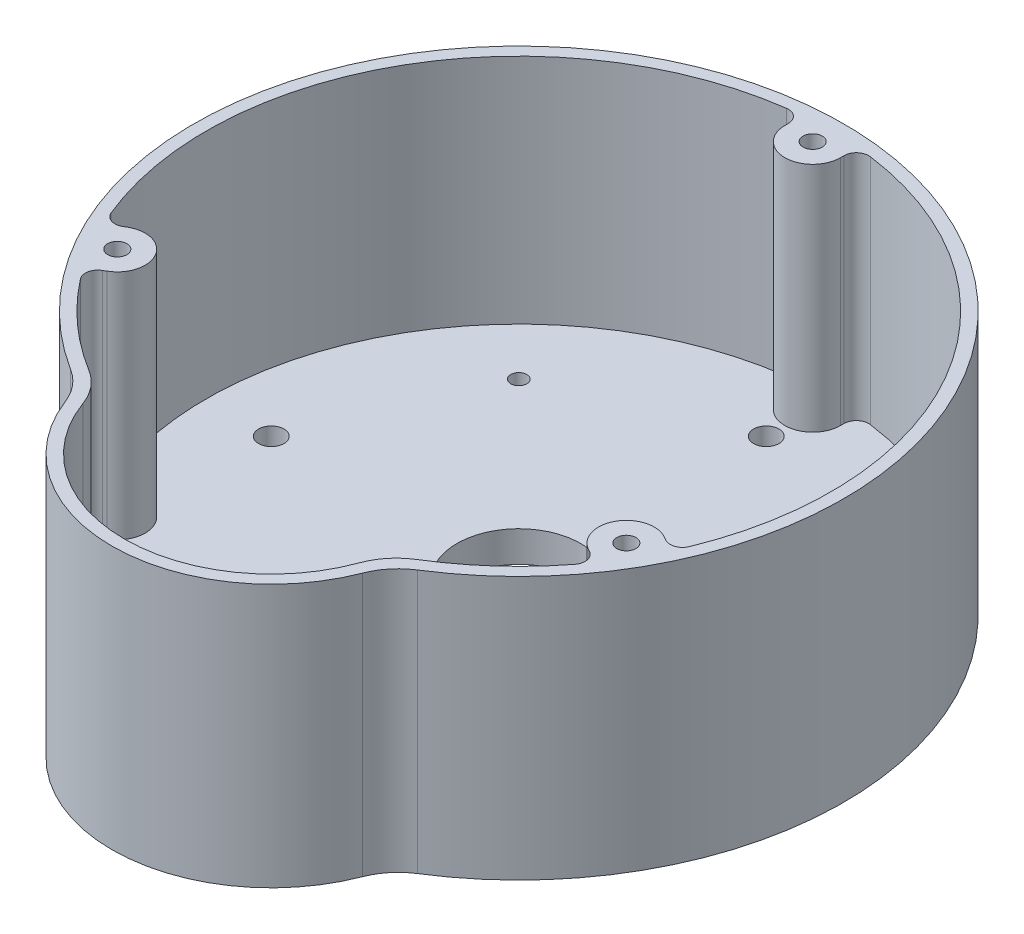
from build123d import *

# Parameters (mm, degrees)
ESQUISSE1_R             = 52.5
ESQUISSE1_R_2           = 2.05
ESQUISSE1_R_3           = 1.3
ESQUISSE1_R_4           = 10
BOSS_EXTRU_2_DEPTH      = 5
ESQUISSE2_R             = 52.5
BOSS_EXTRU_3_DEPTH      = 37.5
ENL_V_START             = -4
ESQUISSE3_R             = 3.35
ENL_V_MAT_EXTRU_1_DEPTH = 82.549693161
ESQUISSE5_R             = 1.55
ENL_V_MAT_EXTRU_3_DEPTH = 86.549693161
ESQUISSE6_R             = 3.75
ENL_V_MAT_EXTRU_4_DEPTH = 3
ESQUISSE7_W             = 25
ESQUISSE7_H             = 37.5
ENL_V_MAT_EXTRU_5_DEPTH = 86.549693161
BOSS_EXTRU_5_DEPTH      = 5
BOSS_EXTRU_9_DEPTH      = 37.5
CONG_1_R                = 10


with BuildPart() as part:
    # Esquisse1 → Boss.-Extru.2 (new body)
    with BuildSketch(Plane(origin=(0, 0, 0), x_dir=(1, 0, 0), z_dir=(0, 1, 0))):
        with Locations(Location((0, 0, 0), (0, 0, 270))):
            Circle(ESQUISSE1_R)
        with Locations(Location((0, 40, 0), (0, 0, 270))):
            Circle(ESQUISSE1_R_2, mode=Mode.SUBTRACT)
        with Locations(Location((40, 0, 0), (0, 0, 270))):
            Circle(ESQUISSE1_R_2, mode=Mode.SUBTRACT)
        with Locations(Location((0, -40, 0), (0, 0, 270))):
            Circle(ESQUISSE1_R_2, mode=Mode.SUBTRACT)
        with Locations(Location((-40, 0, 0), (0, 0, 270))):
            Circle(ESQUISSE1_R_2, mode=Mode.SUBTRACT)
        with Locations(Location((28, 28, 0), (0, 0, 270))):
            Circle(ESQUISSE1_R_3, mode=Mode.SUBTRACT)
        with Locations(Location((20, -42, 0), (0, 0, 270))):
            Circle(ESQUISSE1_R_3, mode=Mode.SUBTRACT)
        with Locations(Location((-20, -42, 0), (0, 0, 90))):
            Circle(ESQUISSE1_R_3, mode=Mode.SUBTRACT)
        with Locations(Location((-28, 28, 0), (0, 0, 90))):
            Circle(ESQUISSE1_R_3, mode=Mode.SUBTRACT)
        with Locations(Location((0, 0, 0), (0, 0, 270))):
            Circle(ESQUISSE1_R_4, mode=Mode.SUBTRACT)
    extrude(amount=BOSS_EXTRU_2_DEPTH)

    # Esquisse2 → Boss.-Extru.3 (add)
    with BuildSketch(Plane(origin=(0, 5, 0), x_dir=(1, 0, 0), z_dir=(0, 1, 0))):
        with Locations(Location((0, 0, 0), (0, 0, 270))):
            Circle(ESQUISSE2_R)
        with BuildLine():
            ThreePointArc((-4.5, 47.5), (0, 43), (4.5, 47.5))
            Line((4.5, 47.5), (4.5, 48.062459363))
            ThreePointArc((4.5, 48.062459363), (5.183960957, 49.568461102), (6.768041237, 50.04441645))
            ThreePointArc((6.768041237, 50.04441645), (43.734282891, 25.25), (46.723756582, -19.16091258))
            ThreePointArc((46.723756582, -19.16091258), (45.519527019, -20.29478867), (43.873310777, -20.134115364))
            Line((43.873310777, -20.134115364), (43.38620668, -19.852885683))
            ThreePointArc((43.38620668, -19.852885683), (37.239092363, -21.5), (38.88620668, -27.647114317))
            Line((38.88620668, -27.647114317), (39.373310777, -27.928343998))
            ThreePointArc((39.373310777, -27.928343998), (40.335566062, -29.273672432), (39.955715345, -30.88350387))
            ThreePointArc((39.955715345, -30.88350387), (0, -50.5), (-39.955715345, -30.88350387))
            ThreePointArc((-39.955715345, -30.88350387), (-40.335566062, -29.273672432), (-39.373310777, -27.928343998))
            Line((-39.373310777, -27.928343998), (-38.88620668, -27.647114317))
            ThreePointArc((-38.88620668, -27.647114317), (-37.239092363, -21.5), (-43.38620668, -19.852885683))
            Line((-43.38620668, -19.852885683), (-43.873310777, -20.134115364))
            ThreePointArc((-43.873310777, -20.134115364), (-45.519527019, -20.29478867), (-46.723756582, -19.16091258))
            ThreePointArc((-46.723756582, -19.16091258), (-43.734282891, 25.25), (-6.768041237, 50.04441645))
            ThreePointArc((-6.768041237, 50.04441645), (-5.183960957, 49.568461102), (-4.5, 48.062459363))
            Line((-4.5, 48.062459363), (-4.5, 47.5))
        make_face(mode=Mode.SUBTRACT)
    extrude(amount=BOSS_EXTRU_3_DEPTH)

    # Esquisse3 → Enlèv. mat.-Extru.1 (cut, through all)
    with BuildSketch(Plane(origin=(0, 42.5, 0), x_dir=(1, 0, 0), z_dir=(0, 1, 0)).offset(ENL_V_START)):
        with Locations(Location((0, 47.5, 0), (0, 0, 270))):
            Circle(ESQUISSE3_R)
        with Locations(Location((41.13620668, -23.75, 0), (0, 0, 270))):
            Circle(ESQUISSE3_R)
        with Locations(Location((-41.13620668, -23.75, 0), (0, 0, 270))):
            Circle(ESQUISSE3_R)
    extrude(amount=-ENL_V_MAT_EXTRU_1_DEPTH, mode=Mode.SUBTRACT)

    # Esquisse5 → Enlèv. mat.-Extru.3 (cut, through all)
    with BuildSketch(Plane(origin=(0, 42.5, 0), x_dir=(1, 0, 0), z_dir=(0, 1, 0))):
        with Locations(Location((-41.13620668, -23.75, 0), (0, 0, 270))):
            Circle(ESQUISSE5_R)
        with Locations(Location((41.13620668, -23.75, 0), (0, 0, 270))):
            Circle(ESQUISSE5_R)
        with Locations(Location((0, 47.5, 0), (0, 0, 270))):
            Circle(ESQUISSE5_R)
    extrude(amount=-ENL_V_MAT_EXTRU_3_DEPTH, mode=Mode.SUBTRACT)

    # Esquisse6 → Enlèv. mat.-Extru.4 (cut)
    with BuildSketch(Plane.XZ):
        with Locations(Location((-20, 42, 0), (0, 0, 270))):
            Circle(ESQUISSE6_R)
        with Locations(Location((20, 42, 0), (0, 0, 270))):
            Circle(ESQUISSE6_R)
        with Locations(Location((-28, -28, 0), (0, 0, 270))):
            Circle(ESQUISSE6_R)
        with Locations(Location((28, -28, 0), (0, 0, 270))):
            Circle(ESQUISSE6_R)
    extrude(amount=-ENL_V_MAT_EXTRU_4_DEPTH, mode=Mode.SUBTRACT)

    # Esquisse7 → Enlèv. mat.-Extru.5 (cut, through all)
    with BuildSketch(Plane.XY):
        with Locations((-12.5, 23.75)):
            Rectangle(ESQUISSE7_W, ESQUISSE7_H)
        with Locations((12.5, 23.75)):
            Rectangle(ESQUISSE7_W, ESQUISSE7_H)
    extrude(amount=ENL_V_MAT_EXTRU_5_DEPTH, mode=Mode.SUBTRACT)

    # Esquisse8 → Boss.-Extru.5 (add)
    with BuildSketch(Plane(origin=(0, 0, 0), x_dir=(1, 0, 0), z_dir=(0, 1, 0))):
        with BuildLine():
            ThreePointArc((-25, -46.165463282), (0, -65.749037603), (25, -46.165463282))
            ThreePointArc((25, -46.165463282), (0, -52.5), (-25, -46.165463282))
        make_face()
    extrude(amount=BOSS_EXTRU_5_DEPTH)

    # Esquisse11 → Boss.-Extru.9 (add)
    with BuildSketch(Plane(origin=(0, 5, 0), x_dir=(1, 0, 0), z_dir=(0, 1, 0))):
        with BuildLine():
            Line((0, -65.749037603), (0, -63.749037603))
            ThreePointArc((0, -63.749037603), (-14.989303659, -58.421117308), (-23.2531293, -44.827915162))
            ThreePointArc((-23.2531293, -44.827915162), (-24.131242464, -44.361392416), (-25, -43.877670859))
            Line((-25, -43.877670859), (-25, -46.165463282))
            ThreePointArc((-25, -46.165463282), (-15.878573481, -60.270269896), (0, -65.749037603))
        make_face()
        with BuildLine():
            ThreePointArc((23.2531293, -44.827915162), (14.989303659, -58.421117308), (0, -63.749037603))
            Line((0, -63.749037603), (0, -65.749037603))
            ThreePointArc((0, -65.749037603), (15.878573481, -60.270269896), (25, -46.165463282))
            Line((25, -46.165463282), (25, -43.877670859))
            ThreePointArc((25, -43.877670859), (24.131242464, -44.361392416), (23.2531293, -44.827915162))
        make_face()
    extrude(amount=BOSS_EXTRU_9_DEPTH)

    # Congé1
    cong_1_edges = [part.edges().sort_by_distance(p)[0] for p in [
        (25, 21.25, 46.165463282),
        (-25, 21.25, 46.165463282),
        (23.2531293, 23.75, 44.827915162),
        (-23.2531293, 23.75, 44.827915162),
    ]]
    fillet(cong_1_edges, radius=CONG_1_R)


solid = part.part
